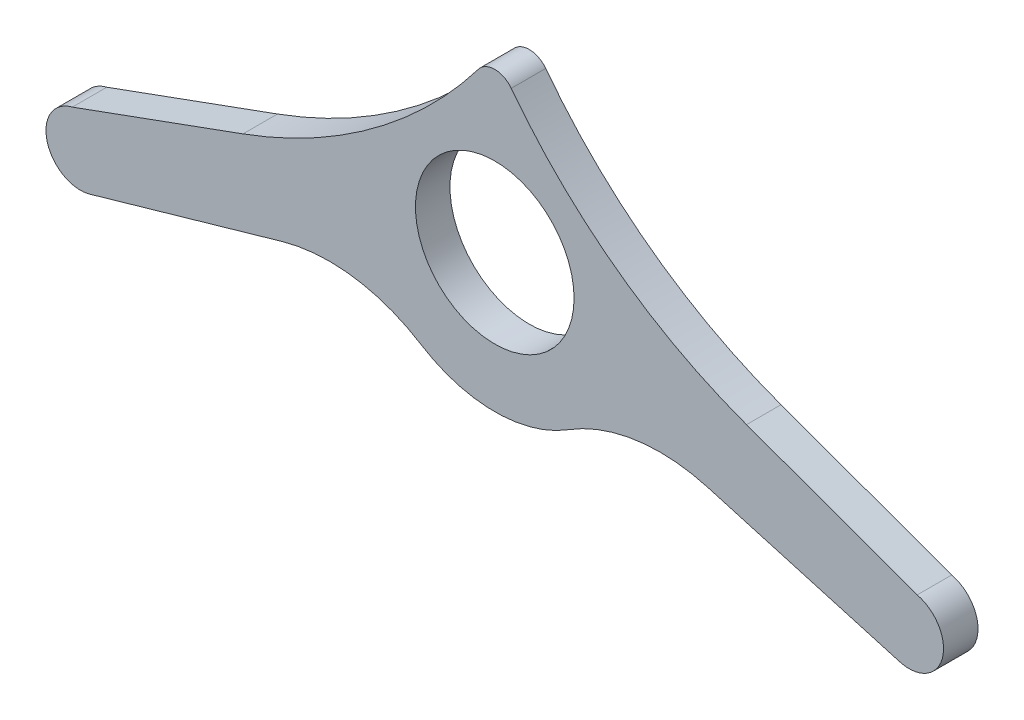
from build123d import *

# Parameters (mm, degrees)
SKETCH1_R           = 11.5
BOSS_EXTRUDE1_DEPTH = 5


with BuildPart() as part:
    # Sketch1 → Boss-Extrude1 (new body)
    with BuildSketch(Plane.XY):
        with BuildLine():
            Line((58.509519869, -21.974669161), (30.868053734, -14.048606291))
            ThreePointArc((30.868053734, -14.048606291), (20.455340601, -13.329450296), (10.656497706, -16.924510529))
            ThreePointArc((10.656497706, -16.924510529), (0, -20), (-10.656497706, -16.924510529))
            ThreePointArc((-10.656497706, -16.924510529), (-20.455340601, -13.329450296), (-30.868053734, -14.048606291))
            Line((-30.868053734, -14.048606291), (-58.509519869, -21.974669161))
            ThreePointArc((-58.509519869, -21.974669161), (-64.885164476, -18.605521518), (-61.263687445, -12.369745374))
            Line((-61.263687445, -12.369745374), (-36.509479216, -3.359950405))
            ThreePointArc((-36.509479216, -3.359950405), (-17.634305645, 6.764909334), (-2.390807306, 21.81219216))
            ThreePointArc((-2.390807306, 21.81219216), (0, 23), (2.390807306, 21.81219216))
            ThreePointArc((2.390807306, 21.81219216), (17.634305645, 6.764909334), (36.509479216, -3.359950405))
            Line((36.509479216, -3.359950405), (61.263687445, -12.369745374))
            ThreePointArc((61.263687445, -12.369745374), (64.885164476, -18.605521518), (58.509519869, -21.974669161))
        make_face()
        Circle(SKETCH1_R, mode=Mode.SUBTRACT)
    extrude(amount=BOSS_EXTRUDE1_DEPTH)


solid = part.part
